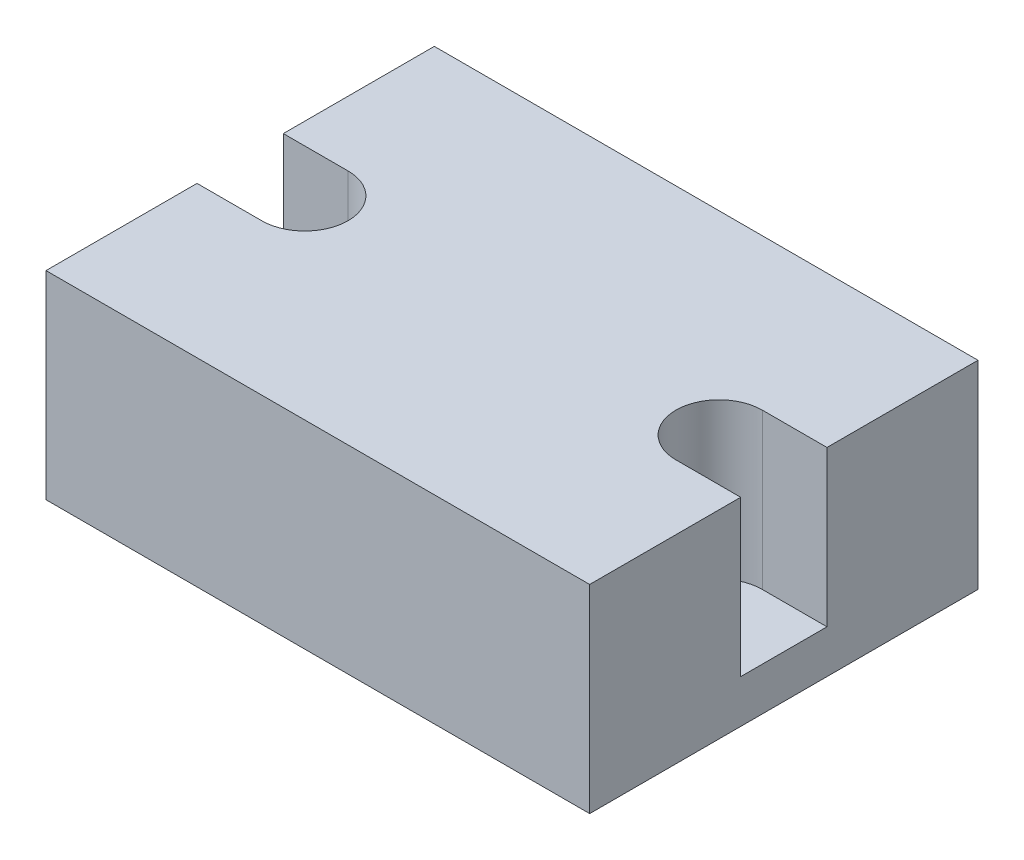
from build123d import *

# Parameters (mm, degrees)
SKETCH1_W           = 63
SKETCH1_H           = 45
BOSS_EXTRUDE1_DEPTH = 23
CUT_EXTRUDE1_DEPTH  = 18


with BuildPart() as part:
    # Sketch1 → Boss-Extrude1 (new body)
    with BuildSketch(Plane(origin=(0, 0, 0), x_dir=(1, 0, 0), z_dir=(0, 1, 0))):
        Rectangle(SKETCH1_W, SKETCH1_H)
    extrude(amount=BOSS_EXTRUDE1_DEPTH)

    # Sketch2 → Cut-Extrude1 (cut)
    with BuildSketch(Plane(origin=(0, 23, 0), x_dir=(1, 0, 0), z_dir=(0, 1, 0))):
        with BuildLine():
            Line((24, 5), (38.956997059, 5))
            ThreePointArc((38.956997059, 5), (43.956997059, 0), (38.956997059, -5))
            Line((38.956997059, -5), (24, -5))
            ThreePointArc((24, -5), (19, 0), (24, 5))
        make_face()
        with BuildLine():
            Line((-24, 5), (-38.956997059, 5))
            ThreePointArc((-38.956997059, 5), (-43.956997059, 0), (-38.956997059, -5))
            Line((-38.956997059, -5), (-24, -5))
            ThreePointArc((-24, -5), (-19, 0), (-24, 5))
        make_face()
    extrude(amount=-CUT_EXTRUDE1_DEPTH, mode=Mode.SUBTRACT)


solid = part.part
